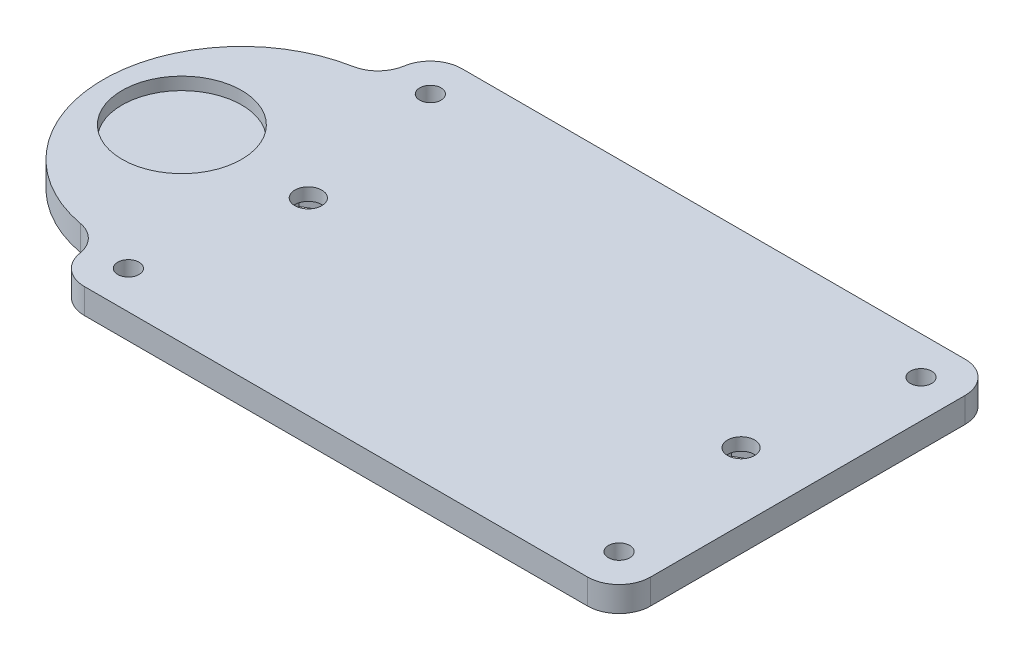
from build123d import *

# Parameters (mm, degrees)
SKETCH1_W           = 90
SKETCH1_H           = 60
BOSS_EXTRUDE1_DEPTH = 4
SKETCH2_R           = 1.7
SKETCH2_R_2         = 2.15
CUT_EXTRUDE1_DEPTH  = 4
CUT_EXTRUDE2_DEPTH  = 2
BOSS_EXTRUDE2_DEPTH = 4
SKETCH5_R           = 9.5
CUT_EXTRUDE3_DEPTH  = 2
FILLET3_R           = 5
FILLET4_R           = 5


with BuildPart() as part:
    # Sketch1 → Boss-Extrude1 (new body)
    with BuildSketch(Plane(origin=(0, 0, 0), x_dir=(1, 0, 0), z_dir=(0, 1, 0))):
        Rectangle(SKETCH1_W, SKETCH1_H)
    extrude(amount=BOSS_EXTRUDE1_DEPTH)

    # Sketch2 → Cut-Extrude1 (cut)
    with BuildSketch(Plane(origin=(0, 4, 0), x_dir=(1, 0, 0), z_dir=(0, 1, 0))):
        with Locations(Location((-39, 24, 0), (0, 0, 270))):
            Circle(SKETCH2_R)
        with Locations(Location((-39, -24, 0), (0, 0, 270))):
            Circle(SKETCH2_R)
        with Locations(Location((39, -24, 0), (0, 0, 270))):
            Circle(SKETCH2_R)
        with Locations(Location((39, 24, 0), (0, 0, 270))):
            Circle(SKETCH2_R)
        with Locations(Location((-34.4, 0, 0), (0, 0, 270))):
            Circle(SKETCH2_R_2)
        with Locations(Location((34.4, 0, 0), (0, 0, 270))):
            Circle(SKETCH2_R_2)
    extrude(amount=-CUT_EXTRUDE1_DEPTH, mode=Mode.SUBTRACT)

    # Sketch3 → Cut-Extrude2 (cut)
    with BuildSketch(Plane.XZ):
        Polygon((-30.825, 2.064027212), (-34.4, 4.128054425), (-37.975, 2.064027212), (-37.975, -2.064027212), (-34.4, -4.128054425), (-30.825, -2.064027212), align=None)
        Polygon((37.975, 2.064027212), (34.4, 4.128054425), (30.825, 2.064027212), (30.825, -2.064027212), (34.4, -4.128054425), (37.975, -2.064027212), align=None)
    extrude(amount=-CUT_EXTRUDE2_DEPTH, mode=Mode.SUBTRACT)

    # Sketch4 → Boss-Extrude2 (add)
    with BuildSketch(Plane(origin=(0, 4, 0), x_dir=(1, 0, 0), z_dir=(0, 1, 0))):
        with BuildLine():
            Line((-45, 22), (-45, -22))
            ThreePointArc((-45, -22), (-67, 0), (-45, 22))
        make_face()
    extrude(amount=-BOSS_EXTRUDE2_DEPTH)

    # Sketch5 → Cut-Extrude3 (cut)
    with BuildSketch(Plane(origin=(0, 4, 0), x_dir=(1, 0, 0), z_dir=(0, 1, 0))):
        with Locations(Location((-54.5, 0, 0), (0, 0, 270))):
            Circle(SKETCH5_R)
    extrude(amount=-CUT_EXTRUDE3_DEPTH, mode=Mode.SUBTRACT)

    # Fillet3
    fillet3_edges = [part.edges().sort_by_distance(p)[0] for p in [
        (-45, 2, -30),
        (45, 2, -30),
        (45, 2, 30),
        (-45, 2, 30),
    ]]
    fillet(fillet3_edges, radius=FILLET3_R)

    # Fillet4
    fillet4_edges = [part.edges().sort_by_distance(p)[0] for p in [
        (-45, 2, -22),
        (-45, 2, 22),
    ]]
    fillet(fillet4_edges, radius=FILLET4_R)


solid = part.part
